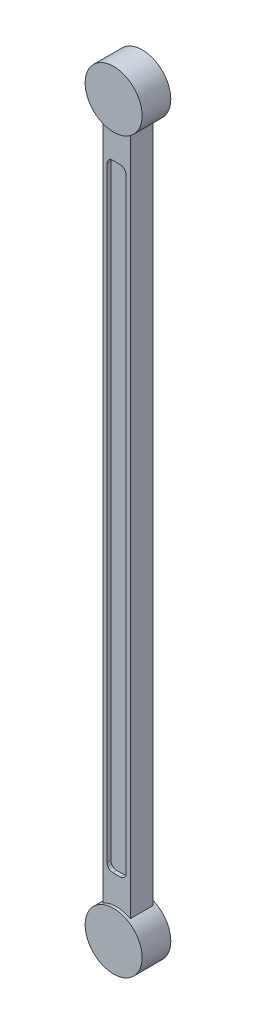
from build123d import *

# Parameters (mm, degrees)
EXTRUDE1_DEPTH      = 19.05
EXTRUDE1_DEPTH_BACK = 19
CUT_EXTRUDE1_DEPTH  = 6.35
CUT_EXTRUDE2_START  = -6.35
CUT_EXTRUDE2_DEPTH  = 6.35
EXTRUDE2_DEPTH      = 4.826
EXTRUDE2_DEPTH_BACK = 43.18
SKETCH6_R           = 47.657715
SKETCH6_R_2         = 47.657166


with BuildPart() as part:
    # Sketch3 → Extrude1 (new, two sides: drawn at the far end of the back side and taken through both)
    with BuildSketch(Plane.XY.offset(-EXTRUDE1_DEPTH_BACK)):
        with BuildLine():
            Line((23, 1178.259012), (23, 41.73971))
            ThreePointArc((23, 41.73971), (0, -47.657144), (-23, 41.73971))
            Line((-23, 41.73971), (-23, 1178.259012))
            ThreePointArc((-23, 1178.259012), (0, 1267.657089), (23, 1178.259012))
        make_face()
    extrude(amount=EXTRUDE1_DEPTH + EXTRUDE1_DEPTH_BACK)

    # Sketch4 → Cut-Extrude1 (cut)
    with BuildSketch(Plane.XY.offset(19.05)):
        with BuildLine():
            Line((15.888, 1116.347374), (15.888, 103.651374))
            ThreePointArc((15.888, 103.651374), (13.060995, 96.826379), (6.236, 93.999374))
            Line((6.236, 93.999374), (-6.236, 93.999374))
            ThreePointArc((-6.236, 93.999374), (-13.060995, 96.826379), (-15.888, 103.651374))
            Line((-15.888, 103.651374), (-15.888, 1116.347374))
            ThreePointArc((-15.888, 1116.347374), (-13.060995, 1123.172368), (-6.236, 1125.999374))
            Line((-6.236, 1125.999374), (6.236, 1125.999374))
            ThreePointArc((6.236, 1125.999374), (13.060995, 1123.172368), (15.888, 1116.347374))
        make_face()
    extrude(amount=-CUT_EXTRUDE1_DEPTH, mode=Mode.SUBTRACT)

    # Sketch5 → Cut-Extrude2 (cut)
    with BuildSketch(Plane(origin=(0, 0, -19), x_dir=(-1, 0, 0), z_dir=(0, 0, -1)).offset(CUT_EXTRUDE2_START)):
        with BuildLine():
            Line((-15.888, 1116.347374), (-15.888, 103.651374))
            ThreePointArc((-15.888, 103.651374), (-13.060995, 96.826379), (-6.236, 93.999374))
            Line((-6.236, 93.999374), (6.236, 93.999374))
            ThreePointArc((6.236, 93.999374), (13.060995, 96.826379), (15.888, 103.651374))
            Line((15.888, 103.651374), (15.888, 1116.347374))
            ThreePointArc((15.888, 1116.347374), (13.060995, 1123.172368), (6.236, 1125.999374))
            Line((6.236, 1125.999374), (-6.236, 1125.999374))
            ThreePointArc((-6.236, 1125.999374), (-13.060995, 1123.172368), (-15.888, 1116.347374))
        make_face()
    extrude(amount=CUT_EXTRUDE2_DEPTH, mode=Mode.SUBTRACT)

    # Sketch6 → Extrude2 (add, two sides: drawn at the far end of the back side and taken through both)
    with BuildSketch(Plane.XY.offset(19.05).offset(-EXTRUDE2_DEPTH_BACK)):
        with Locations((0, 1219.999374)):
            Circle(SKETCH6_R)
        Circle(SKETCH6_R_2)
    extrude(amount=EXTRUDE2_DEPTH + EXTRUDE2_DEPTH_BACK)


solid = part.part
